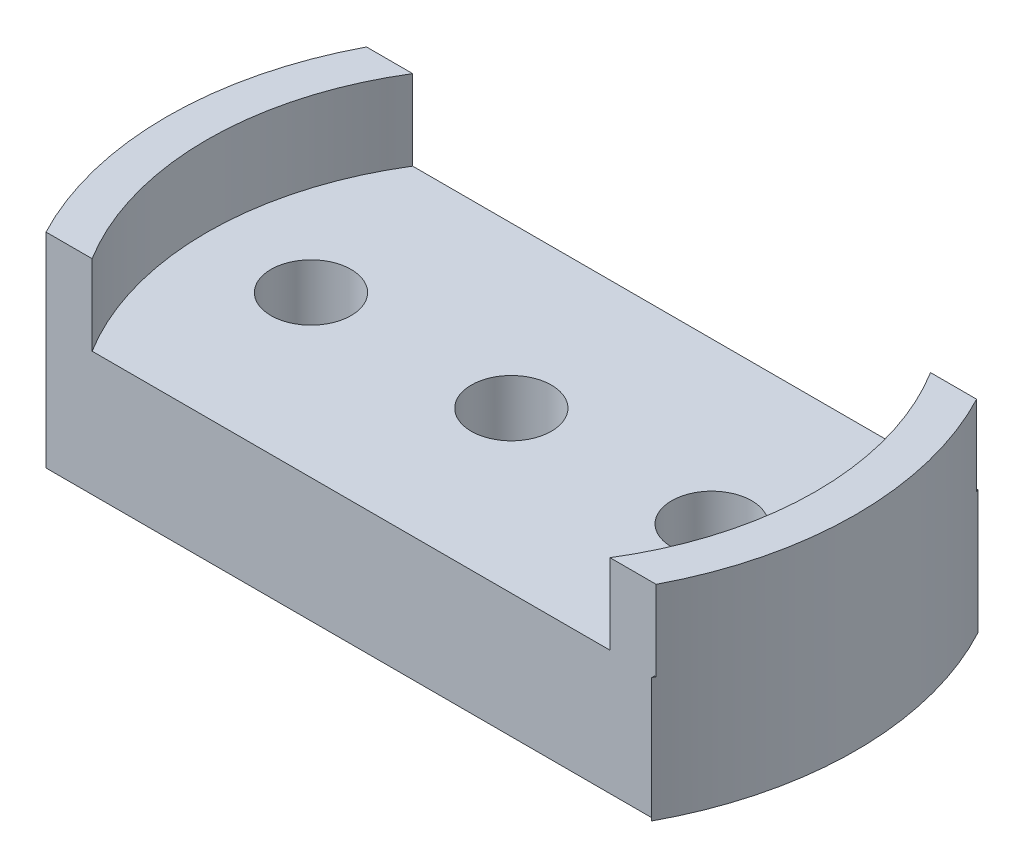
from build123d import *
from build123d.topology import SkipClean

# Parameters (mm, degrees)
SKETCH3_R           = 43
BOSS_EXTRUDE2_DEPTH = 15.5
BOSS_EXTRUDE5_DEPTH = 10
SKETCH9_W           = 75.940248911
SKETCH9_H           = 24.034829181
CUT_EXTRUDE8_DEPTH  = 20
SKETCH10_R          = 5
CUT_EXTRUDE9_DEPTH  = 20
SKETCH11_R          = 5
CUT_EXTRUDE10_DEPTH = 20


with BuildPart() as part:
    # Sketch3 → Boss-Extrude2 (new body)
    with BuildSketch(Plane(origin=(0, 0, 0), x_dir=(1, 0, 0), z_dir=(0, 1, 0))):
        with Locations(Location((0, 0, 0), (0, 0, 270))):
            Circle(SKETCH3_R)
    extrude(amount=BOSS_EXTRUDE2_DEPTH)

    # Sketch4 → Boss-Extrude5 (add)
    with SkipClean():  # the faces are left unmerged after this step: merging them gives an invalid solid
        with BuildSketch(Plane(origin=(0, 15.5, 0), x_dir=(1, 0, 0), z_dir=(0, 1, 0))):
            with BuildLine():
                Line((-38.065732621, 20), (-32.310988843, 20))
                ThreePointArc((-32.310988843, 20), (-38, 0), (-32.310988843, -20))
                Line((-32.310988843, -20), (-38.065732621, -20))
                ThreePointArc((-38.065732621, -20), (-43, 0), (-38.065732621, 20))
            make_face()
            with BuildLine():
                Line((32.310988843, 20), (38.065732621, 20))
                ThreePointArc((38.065732621, 20), (43, 0), (38.065732621, -20))
                Line((38.065732621, -20), (32.310988843, -20))
                ThreePointArc((32.310988843, -20), (38, 0), (32.310988843, 20))
            make_face()
        extrude(amount=BOSS_EXTRUDE5_DEPTH)

    # Sketch9 → Cut-Extrude8 (cut)
    with BuildSketch(Plane(origin=(0, 15.5, 0), x_dir=(1, 0, 0), z_dir=(0, 1, 0))):
        with Locations((-0.095608165, -32.01741459)):
            Rectangle(SKETCH9_W, SKETCH9_H)
        with Locations((-0.095608165, 32.01741459)):
            Rectangle(SKETCH9_W, SKETCH9_H)
    extrude(amount=-CUT_EXTRUDE8_DEPTH, mode=Mode.SUBTRACT)

    # Sketch10 → Cut-Extrude9 (cut)
    with BuildSketch(Plane.XZ):
        with Locations(Location((0, 0, 0), (0, 0, 270))):
            Circle(SKETCH10_R)
    extrude(amount=-CUT_EXTRUDE9_DEPTH, mode=Mode.SUBTRACT)

    # Sketch11 → Cut-Extrude10 (cut)
    with BuildSketch(Plane.XZ):
        with Locations(Location((25, 0, 0), (0, 0, 270))):
            Circle(SKETCH11_R)
        with Locations(Location((-25, 0, 0), (0, 0, 90))):
            Circle(SKETCH11_R)
    extrude(amount=-CUT_EXTRUDE10_DEPTH, mode=Mode.SUBTRACT)


solid = part.part
